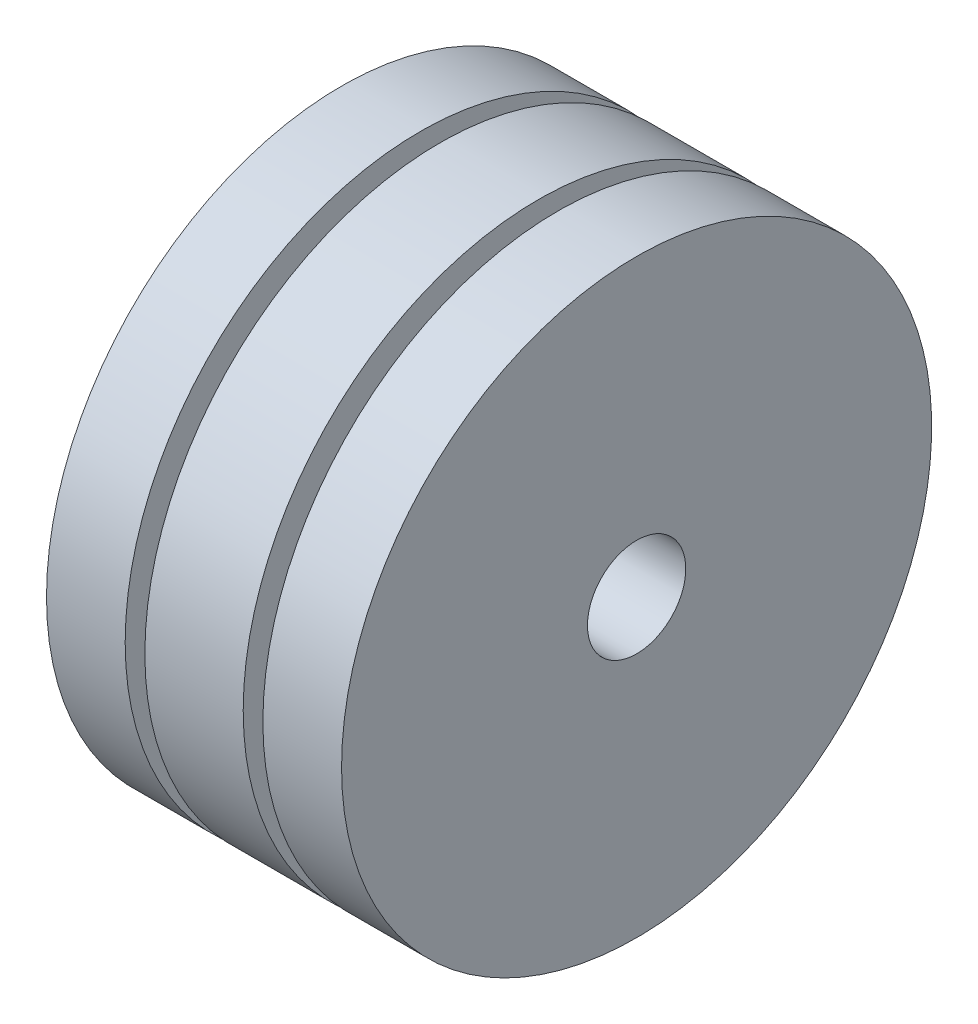
from build123d import *


with BuildPart() as part:
    # Sketch1 → Revolve1 (revolve)
    with BuildSketch(Plane(origin=(0, 0, 0), x_dir=(1, 0, 0), z_dir=(0, 1, 0))):
        Polygon((-5, -12.5), (5, -12.5), (5, 7.5), (7, 7.5), (7, -12.5), (15, -12.5), (15, 12.5), (-15, 12.5), (-15, -12.5), (-7, -12.5), (-7, 7.5), (-5, 7.5), align=None)
    revolve(axis=Axis((-32.464503697, 0, -17.5), (1, 0, 0)))


solid = part.part
